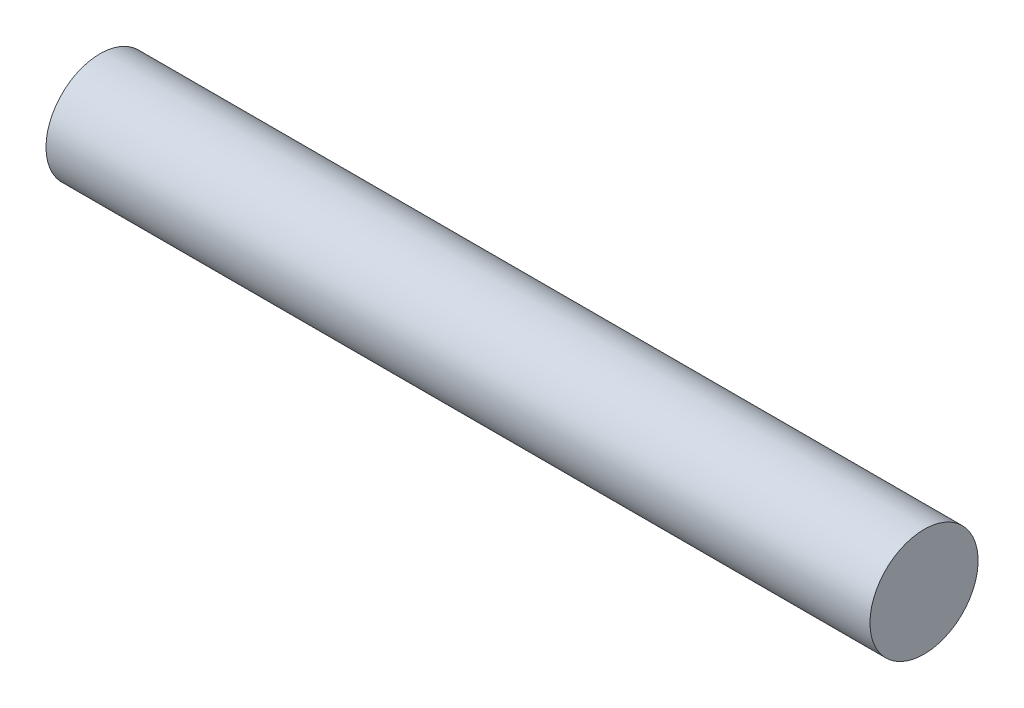
from build123d import *

# Parameters (mm, degrees)
SKETCH1_R           = 5
BOSS_EXTRUDE1_DEPTH = 76.2


with BuildPart() as part:
    # Sketch1 → Boss-Extrude1 (new body)
    with BuildSketch(Plane(origin=(0, 0, 0), x_dir=(0, 0, -1), z_dir=(1, 0, 0))):
        with Locations(Location((0, 0, 0), (0, 0, 180))):
            Circle(SKETCH1_R)
    extrude(amount=BOSS_EXTRUDE1_DEPTH)


solid = part.part
